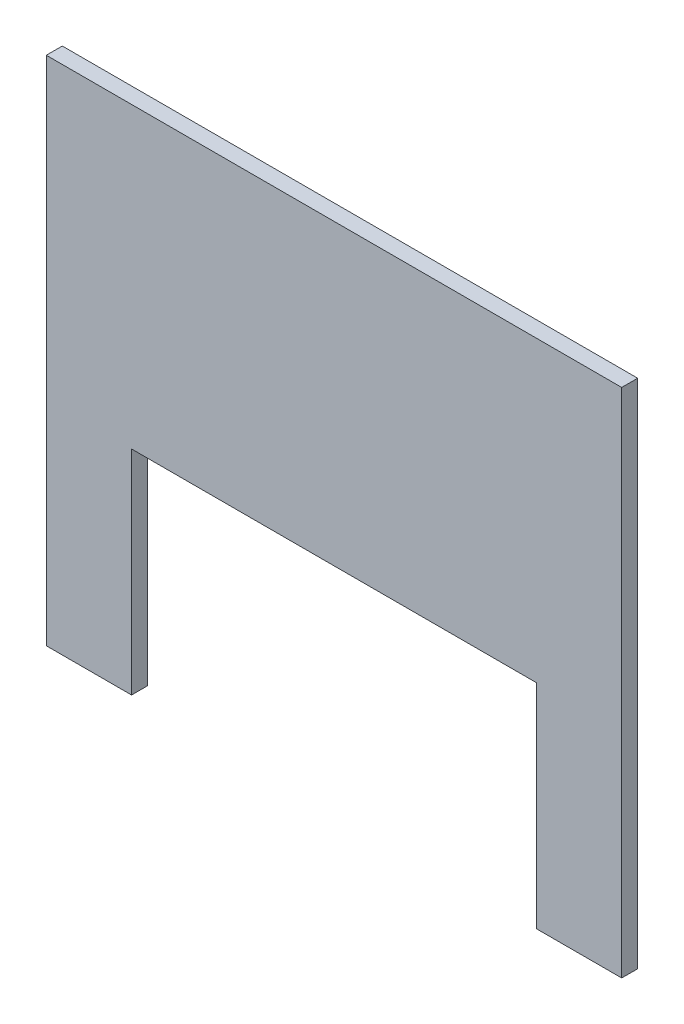
from build123d import *

# Parameters (mm, degrees)
BOSS_EXTRUDE1_DEPTH = 4.7625


with BuildPart() as part:
    # Sketch1 → Boss-Extrude1 (new body)
    with BuildSketch(Plane.XY):
        Polygon((0, 0), (25.4, 0), (25.4, 63.5), (146.05, 63.5), (146.05, 0), (171.45, 0), (171.45, 152.4), (0, 152.4), align=None)
    extrude(amount=BOSS_EXTRUDE1_DEPTH)


solid = part.part
